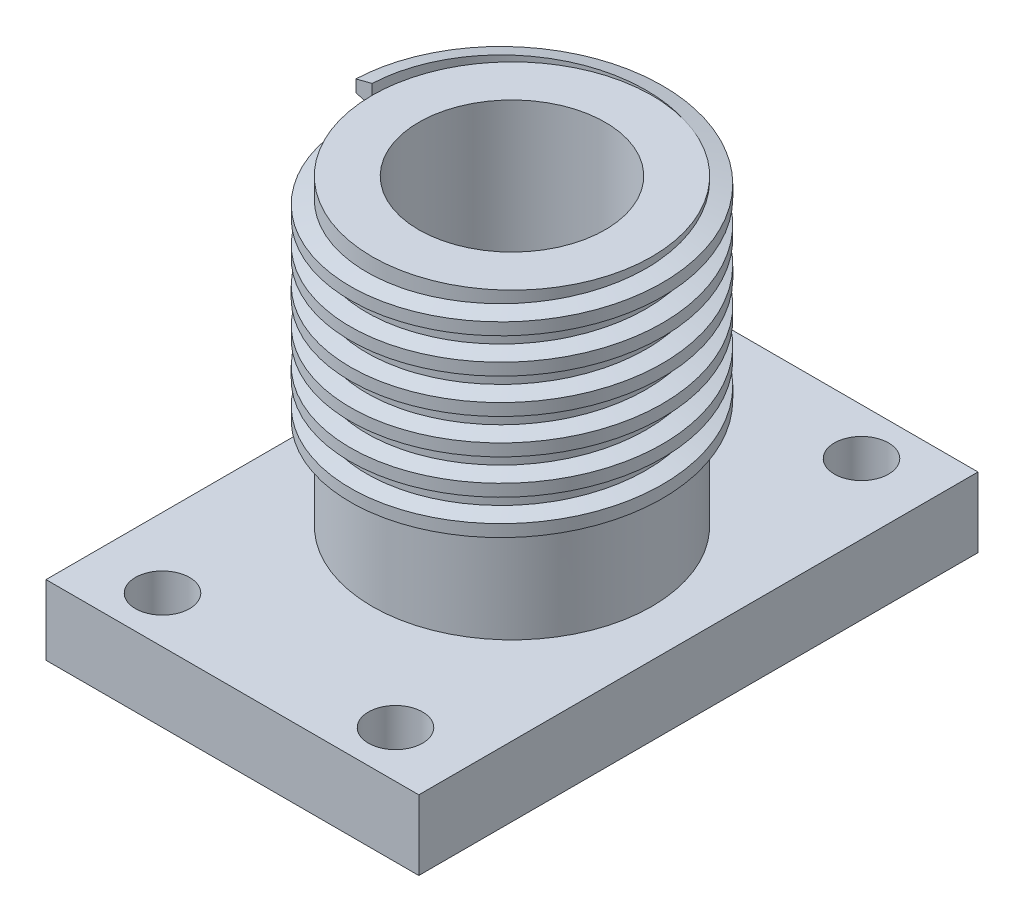
from build123d import *

# Parameters (mm, degrees)
SKETCH1_R           = 15.24
SKETCH1_R_2         = 10.16
BOSS_EXTRUDE1_DEPTH = 33.02
BOSS_EXTRUDE2_START = -7.62
SKETCH1_3_W         = 40.64
SKETCH1_3_H         = 60.96
SKETCH1_3_R         = 2.95275
SKETCH1_3_R_2       = 15.24
SKETCH1_3_R_3       = 10.16
BOSS_EXTRUDE2_DEPTH = 7.62
SWEEP1_PITCH        = 3.81
SWEEP1_HEIGHT       = 22.86
SWEEP1_RADIUS       = 15.24
SWEEP1_START_ANGLE  = -90


with BuildPart() as part:
    # Sketch1 → Boss-Extrude1 (new body)
    with BuildSketch(Plane(origin=(0, 0, 0), x_dir=(1, 0, 0), z_dir=(0, 1, 0))):
        with Locations(Location((0, 0, 0), (0, 0, 270))):
            Circle(SKETCH1_R)
        with Locations(Location((0, 0, 0), (0, 0, 270))):
            Circle(SKETCH1_R_2, mode=Mode.SUBTRACT)
    extrude(amount=BOSS_EXTRUDE1_DEPTH)

    # Sketch1<3> → Boss-Extrude2 (add)
    # profile 1 of 2: a face of its own
    with BuildSketch(Plane(origin=(0, 0, 0), x_dir=(1, 0, 0), z_dir=(0, 1, 0)).offset(BOSS_EXTRUDE2_START)):
        Rectangle(SKETCH1_3_W, SKETCH1_3_H)
        with Locations(Location((-12.7, -25.4, 0), (0, 0, 270))):
            Circle(SKETCH1_3_R, mode=Mode.SUBTRACT)
        with Locations(Location((-12.7, 25.4, 0), (0, 0, 270))):
            Circle(SKETCH1_3_R, mode=Mode.SUBTRACT)
        with Locations(Location((12.7, -25.4, 0), (0, 0, 270))):
            Circle(SKETCH1_3_R, mode=Mode.SUBTRACT)
        with Locations(Location((12.7, 25.4, 0), (0, 0, 270))):
            Circle(SKETCH1_3_R, mode=Mode.SUBTRACT)
        with Locations(Location((0, 0, 0), (0, 0, 270))):
            Circle(SKETCH1_3_R_2, mode=Mode.SUBTRACT)
    # profile 2 of 2: a face of its own
    with BuildSketch(Plane(origin=(0, 0, 0), x_dir=(1, 0, 0), z_dir=(0, 1, 0)).offset(BOSS_EXTRUDE2_START)):
        with Locations(Location((0, 0, 0), (0, 0, 270))):
            Circle(SKETCH1_3_R_2)
        with Locations(Location((0, 0, 0), (0, 0, 270))):
            Circle(SKETCH1_3_R_3, mode=Mode.SUBTRACT)
    extrude(amount=BOSS_EXTRUDE2_DEPTH)

    # Sweep1: sweep along a helix
    with BuildLine() as sweep1_path:
        add(Helix(SWEEP1_PITCH, SWEEP1_HEIGHT, SWEEP1_RADIUS, center=(0, 33.02, 0), direction=(0, -1, 0), mode=Mode.PRIVATE).rotate(Axis((0, 33.02, 0), (0, -1, 0)), SWEEP1_START_ANGLE))
    # Sketch10 → Sweep1 (sweep)
    with BuildSketch(Plane.XY):
        Polygon((-15.239773805, 30.328908081), (-15.239773805, 28.091086016), (-17.017773805, 28.550908081), (-17.017773805, 29.869086016), align=None)
    sweep(path=sweep1_path.line, is_frenet=True)


solid = part.part
